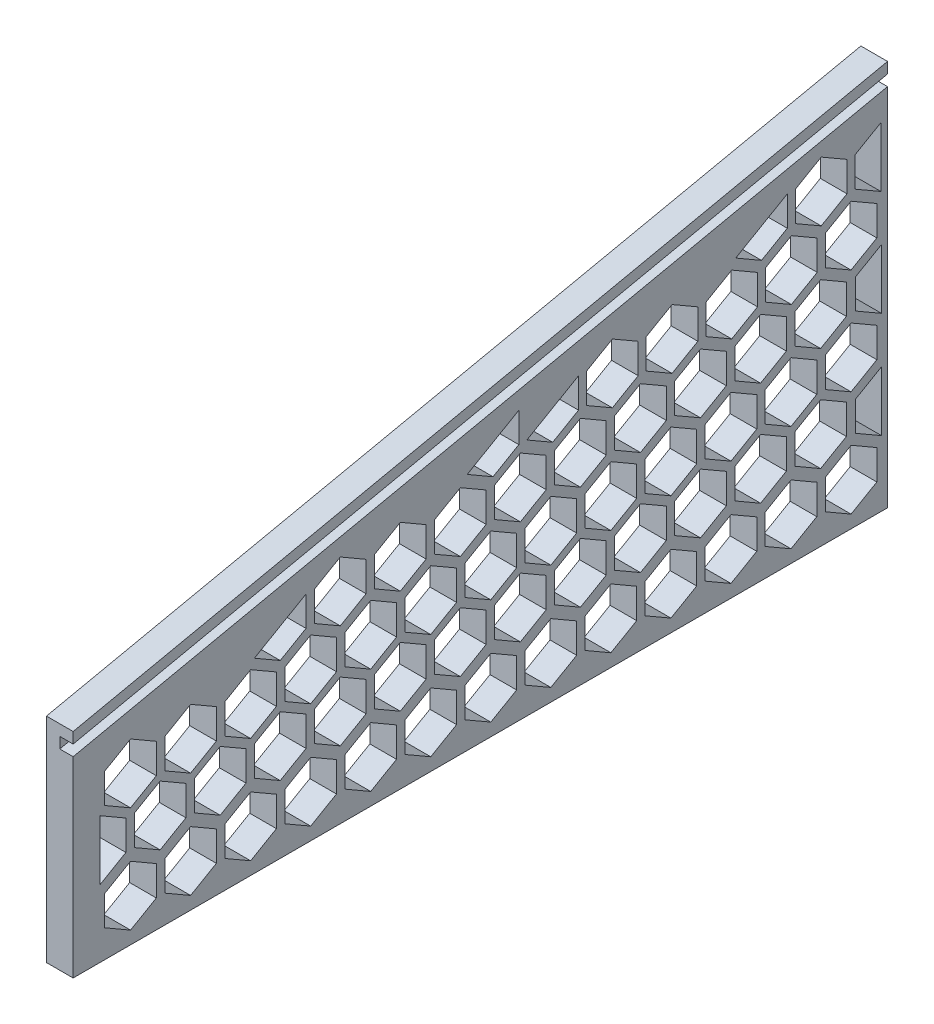
from build123d import *

# Parameters (mm, degrees)
BOSS_EXTRUDE1_DEPTH = 5
CUT_EXTRUDE1_DEPTH  = 10
SKETCH4_W           = 152.591025714
SKETCH4_H           = 40
BOSS_EXTRUDE3_DEPTH = 5
CUT_EXTRUDE3_DEPTH  = 5
CUT_EXTRUDE4_DEPTH  = 2.5


with BuildPart() as part:
    # Sketch1 → Boss-Extrude1 (new body)
    with BuildSketch(Plane(origin=(0, 0, 0), x_dir=(0, 0, -1), z_dir=(1, 0, 0))):
        Polygon((152.591025714, 32.434223768), (0, 0), (152.591025714, 0), align=None)
    extrude(amount=BOSS_EXTRUDE1_DEPTH)

    # Sketch2 → Cut-Extrude1 (cut)
    with BuildSketch(Plane(origin=(5, 0, 0), x_dir=(0, 0, -1), z_dir=(1, 0, 0))):
        Polygon((151.341025714, 11.955858852), (151.341025714, 23.12302347), (146.505501591, 20.331232316), (146.505501591, 14.747650007), align=None)
        Polygon((73.839977467, 4.791791155), (83.511025714, 10.375373464), (83.511025714, 4.791791155), (78.675501591, 2), align=None)
        Polygon((133.816549838, 20.331232316), (124.145501591, 14.747650007), (128.981025714, 11.955858852), (133.816549838, 14.747650007), align=None)
        Polygon((94.691025714, 10.375373464), (85.019977467, 4.791791155), (89.855501591, 2), (94.691025714, 4.791791155), align=None)
        Polygon((145.755501591, 13.167164618), (140.919977467, 10.375373464), (140.919977467, 4.791791155), (145.755501591, 2), (150.591025714, 4.791791155), (150.591025714, 10.375373464), align=None)
        Polygon((134.575501591, 13.167164618), (129.739977467, 10.375373464), (129.739977467, 4.791791155), (134.575501591, 2), (139.411025714, 4.791791155), (139.411025714, 10.375373464), align=None)
        Polygon((140.161025714, 11.955858852), (135.325501591, 14.747650007), (135.325501591, 20.331232316), (140.161025714, 23.12302347), (144.996549838, 20.331232316), (144.996549838, 14.747650007), align=None)
        Polygon((123.395501591, 13.167164618), (118.559977467, 10.375373464), (118.559977467, 4.791791155), (123.395501591, 2), (128.231025714, 4.791791155), (128.231025714, 10.375373464), align=None)
        Polygon((112.215501591, 13.167164618), (107.379977467, 10.375373464), (107.379977467, 4.791791155), (112.215501591, 2), (117.051025714, 4.791791155), (117.051025714, 10.375373464), align=None)
        Polygon((101.035501591, 13.167164618), (96.199977467, 10.375373464), (96.199977467, 4.791791155), (101.035501591, 2), (105.871025714, 4.791791155), (105.871025714, 10.375373464), align=None)
    extrude(amount=-CUT_EXTRUDE1_DEPTH, mode=Mode.SUBTRACT)

    # Sketch4 → Boss-Extrude3 (add)
    with BuildSketch(Plane.ZY):
        with Locations((-76.295512857, -20)):
            Rectangle(SKETCH4_W, SKETCH4_H)
    extrude(amount=-BOSS_EXTRUDE3_DEPTH)

    # Sketch6 → Cut-Extrude3 (cut)
    with BuildSketch(Plane(origin=(5, 0, 0), x_dir=(0, 0, -1), z_dir=(1, 0, 0))):
        Polygon((140.049977467, -16.195093048), (144.885501591, -18.986884203), (144.885501591, -24.570466512), (140.049977467, -27.362257666), (135.214453343, -24.570466512), (135.214453343, -18.986884203), align=None)
        Polygon((145.755501591, -6.597350714), (150.591025714, -9.389141869), (150.591025714, -14.972724178), (145.755501591, -17.764515332), (140.919977467, -14.972724178), (140.919977467, -9.389141869), align=None)
        Polygon((150.591025714, 4.791791155), (150.591025714, 10.375373464), (145.755501591, 13.167164618), (140.919977467, 10.375373464), (140.919977467, 4.791791155), (145.755501591, 2), align=None)
        Polygon((140.049977467, 3.284906952), (144.885501591, 0.493115797), (144.885501591, -5.090466512), (140.049977467, -7.882257666), (135.214453343, -5.090466512), (135.214453343, 0.493115797), align=None)
        Polygon((146.625501591, -5.090466512), (151.461025714, -7.882257666), (151.461025714, 3.284906952), (146.625501591, 0.493115797), align=None)
        Polygon((145.755501591, -26.437350714), (150.591025714, -29.229141869), (150.591025714, -34.812724178), (145.755501591, -37.604515332), (140.919977467, -34.812724178), (140.919977467, -29.229141869), align=None)
        Polygon((134.505501591, -26.437350714), (139.341025714, -29.229141869), (139.341025714, -34.812724178), (134.505501591, -37.604515332), (129.669977467, -34.812724178), (129.669977467, -29.229141869), align=None)
        Polygon((128.799977467, -16.195093048), (133.635501591, -18.986884203), (133.635501591, -24.570466512), (128.799977467, -27.362257666), (123.964453343, -24.570466512), (123.964453343, -18.986884203), align=None)
        Polygon((134.505501591, -6.597350714), (139.341025714, -9.389141869), (139.341025714, -14.972724178), (134.505501591, -17.764515332), (129.669977467, -14.972724178), (129.669977467, -9.389141869), align=None)
        Polygon((128.799977467, 3.284906952), (133.635501591, 0.493115797), (133.635501591, -5.090466512), (128.799977467, -7.882257666), (123.964453343, -5.090466512), (123.964453343, 0.493115797), align=None)
        Polygon((123.255501591, -26.437350714), (128.091025714, -29.229141869), (128.091025714, -34.812724178), (123.255501591, -37.604515332), (118.419977467, -34.812724178), (118.419977467, -29.229141869), align=None)
        Polygon((117.549977467, -16.195093048), (122.385501591, -18.986884203), (122.385501591, -24.570466512), (117.549977467, -27.362257666), (112.714453343, -24.570466512), (112.714453343, -18.986884203), align=None)
        Polygon((123.255501591, -6.597350714), (128.091025714, -9.389141869), (128.091025714, -14.972724178), (123.255501591, -17.764515332), (118.419977467, -14.972724178), (118.419977467, -9.389141869), align=None)
        Polygon((117.549977467, 3.284906952), (122.385501591, 0.493115797), (122.385501591, -5.090466512), (117.549977467, -7.882257666), (112.714453343, -5.090466512), (112.714453343, 0.493115797), align=None)
        Polygon((112.005501591, -26.437350714), (116.841025714, -29.229141869), (116.841025714, -34.812724178), (112.005501591, -37.604515332), (107.169977467, -34.812724178), (107.169977467, -29.229141869), align=None)
        Polygon((106.299977467, -16.195093048), (111.135501591, -18.986884203), (111.135501591, -24.570466512), (106.299977467, -27.362257666), (101.464453343, -24.570466512), (101.464453343, -18.986884203), align=None)
        Polygon((112.005501591, -6.597350714), (116.841025714, -9.389141869), (116.841025714, -14.972724178), (112.005501591, -17.764515332), (107.169977467, -14.972724178), (107.169977467, -9.389141869), align=None)
        Polygon((106.299977467, 3.284906952), (111.135501591, 0.493115797), (111.135501591, -5.090466512), (106.299977467, -7.882257666), (101.464453343, -5.090466512), (101.464453343, 0.493115797), align=None)
        Polygon((100.755501591, -26.437350714), (105.591025714, -29.229141869), (105.591025714, -34.812724178), (100.755501591, -37.604515332), (95.919977467, -34.812724178), (95.919977467, -29.229141869), align=None)
        Polygon((95.049977467, -16.195093048), (99.885501591, -18.986884203), (99.885501591, -24.570466512), (95.049977467, -27.362257666), (90.214453343, -24.570466512), (90.214453343, -18.986884203), align=None)
        Polygon((100.755501591, -6.597350714), (105.591025714, -9.389141869), (105.591025714, -14.972724178), (100.755501591, -17.764515332), (95.919977467, -14.972724178), (95.919977467, -9.389141869), align=None)
        Polygon((95.049977467, 3.284906952), (99.885501591, 0.493115797), (99.885501591, -5.090466512), (95.049977467, -7.882257666), (90.214453343, -5.090466512), (90.214453343, 0.493115797), align=None)
        Polygon((89.505501591, -26.437350714), (94.341025714, -29.229141869), (94.341025714, -34.812724178), (89.505501591, -37.604515332), (84.669977467, -34.812724178), (84.669977467, -29.229141869), align=None)
        Polygon((83.799977467, -16.195093048), (88.635501591, -18.986884203), (88.635501591, -24.570466512), (83.799977467, -27.362257666), (78.964453343, -24.570466512), (78.964453343, -18.986884203), align=None)
        Polygon((89.505501591, -6.597350714), (94.341025714, -9.389141869), (94.341025714, -14.972724178), (89.505501591, -17.764515332), (84.669977467, -14.972724178), (84.669977467, -9.389141869), align=None)
        Polygon((83.799977467, 3.284906952), (88.635501591, 0.493115797), (88.635501591, -5.090466512), (83.799977467, -7.882257666), (78.964453343, -5.090466512), (78.964453343, 0.493115797), align=None)
        Polygon((78.255501591, -26.437350714), (83.091025714, -29.229141869), (83.091025714, -34.812724178), (78.255501591, -37.604515332), (73.419977467, -34.812724178), (73.419977467, -29.229141869), align=None)
        Polygon((72.549977467, -16.195093048), (77.385501591, -18.986884203), (77.385501591, -24.570466512), (72.549977467, -27.362257666), (67.714453343, -24.570466512), (67.714453343, -18.986884203), align=None)
        Polygon((78.255501591, -6.597350714), (83.091025714, -9.389141869), (83.091025714, -14.972724178), (78.255501591, -17.764515332), (73.419977467, -14.972724178), (73.419977467, -9.389141869), align=None)
        Polygon((72.549977467, 3.284906952), (77.385501591, 0.493115797), (77.385501591, -5.090466512), (72.549977467, -7.882257666), (67.714453343, -5.090466512), (67.714453343, 0.493115797), align=None)
        Polygon((67.005501591, -26.437350714), (71.841025714, -29.229141869), (71.841025714, -34.812724178), (67.005501591, -37.604515332), (62.169977467, -34.812724178), (62.169977467, -29.229141869), align=None)
        Polygon((61.299977467, -16.195093048), (66.135501591, -18.986884203), (66.135501591, -24.570466512), (61.299977467, -27.362257666), (56.464453343, -24.570466512), (56.464453343, -18.986884203), align=None)
        Polygon((67.005501591, -6.597350714), (71.841025714, -9.389141869), (71.841025714, -14.972724178), (67.005501591, -17.764515332), (62.169977467, -14.972724178), (62.169977467, -9.389141869), align=None)
        Polygon((61.299977467, 3.284906952), (66.135501591, 0.493115797), (66.135501591, -5.090466512), (61.299977467, -7.882257666), (56.464453343, -5.090466512), (56.464453343, 0.493115797), align=None)
        Polygon((55.755501591, -26.437350714), (60.591025714, -29.229141869), (60.591025714, -34.812724178), (55.755501591, -37.604515332), (50.919977467, -34.812724178), (50.919977467, -29.229141869), align=None)
        Polygon((50.049977467, -16.195093048), (54.885501591, -18.986884203), (54.885501591, -24.570466512), (50.049977467, -27.362257666), (45.214453343, -24.570466512), (45.214453343, -18.986884203), align=None)
        Polygon((55.755501591, -6.597350714), (60.591025714, -9.389141869), (60.591025714, -14.972724178), (55.755501591, -17.764515332), (50.919977467, -14.972724178), (50.919977467, -9.389141869), align=None)
        Polygon((50.049977467, 3.284906952), (54.885501591, 0.493115797), (54.885501591, -5.090466512), (50.049977467, -7.882257666), (45.214453343, -5.090466512), (45.214453343, 0.493115797), align=None)
        Polygon((44.505501591, -26.437350714), (49.341025714, -29.229141869), (49.341025714, -34.812724178), (44.505501591, -37.604515332), (39.669977467, -34.812724178), (39.669977467, -29.229141869), align=None)
        Polygon((38.799977467, -16.195093048), (43.635501591, -18.986884203), (43.635501591, -24.570466512), (38.799977467, -27.362257666), (33.964453343, -24.570466512), (33.964453343, -18.986884203), align=None)
        Polygon((44.505501591, -6.597350714), (49.341025714, -9.389141869), (49.341025714, -14.972724178), (44.505501591, -17.764515332), (39.669977467, -14.972724178), (39.669977467, -9.389141869), align=None)
        Polygon((43.635501591, 0.493115797), (43.635501591, -5.090466512), (38.799977467, -7.882257666), (33.964453343, -5.090466512), align=None)
        Polygon((33.255501591, -26.437350714), (38.091025714, -29.229141869), (38.091025714, -34.812724178), (33.255501591, -37.604515332), (28.419977467, -34.812724178), (28.419977467, -29.229141869), align=None)
        Polygon((27.549977467, -16.195093048), (32.385501591, -18.986884203), (32.385501591, -24.570466512), (27.549977467, -27.362257666), (22.714453343, -24.570466512), (22.714453343, -18.986884203), align=None)
        Polygon((33.255501591, -6.597350714), (38.091025714, -9.389141869), (38.091025714, -14.972724178), (33.255501591, -17.764515332), (28.419977467, -14.972724178), (28.419977467, -9.389141869), align=None)
        Polygon((22.005501591, -26.437350714), (26.841025714, -29.229141869), (26.841025714, -34.812724178), (22.005501591, -37.604515332), (17.169977467, -34.812724178), (17.169977467, -29.229141869), align=None)
        Polygon((16.299977467, -16.195093048), (21.135501591, -18.986884203), (21.135501591, -24.570466512), (16.299977467, -27.362257666), (11.464453343, -24.570466512), (11.464453343, -18.986884203), align=None)
        Polygon((22.005501591, -6.597350714), (26.841025714, -9.389141869), (26.841025714, -14.972724178), (22.005501591, -17.764515332), (17.169977467, -14.972724178), (17.169977467, -9.389141869), align=None)
        Polygon((10.755501591, -26.437350714), (15.591025714, -29.229141869), (15.591025714, -34.812724178), (10.755501591, -37.604515332), (5.919977467, -34.812724178), (5.919977467, -29.229141869), align=None)
        Polygon((5.049977467, -16.195093048), (9.885501591, -18.986884203), (9.885501591, -24.570466512), (5.049977467, -27.362257666), align=None)
        Polygon((10.755501591, -6.597350714), (15.591025714, -9.389141869), (15.591025714, -14.972724178), (10.755501591, -17.764515332), (5.919977467, -14.972724178), (5.919977467, -9.389141869), align=None)
        Polygon((151.461025714, -16.555093048), (146.625501591, -19.346884203), (146.625501591, -24.930466512), (151.461025714, -27.722257666), align=None)
    extrude(amount=-CUT_EXTRUDE3_DEPTH, mode=Mode.SUBTRACT)

    # Sketch7 → Cut-Extrude4 (cut)
    with BuildSketch(Plane(origin=(5, 0, 0), x_dir=(0, 0, -1), z_dir=(1, 0, 0))):
        Polygon((0, -2.04468119), (152.591025714, 30.389542578), (152.591025714, 28.344861388), (0, -4.089362379), align=None)
    extrude(amount=-CUT_EXTRUDE4_DEPTH, mode=Mode.SUBTRACT)


solid = part.part
